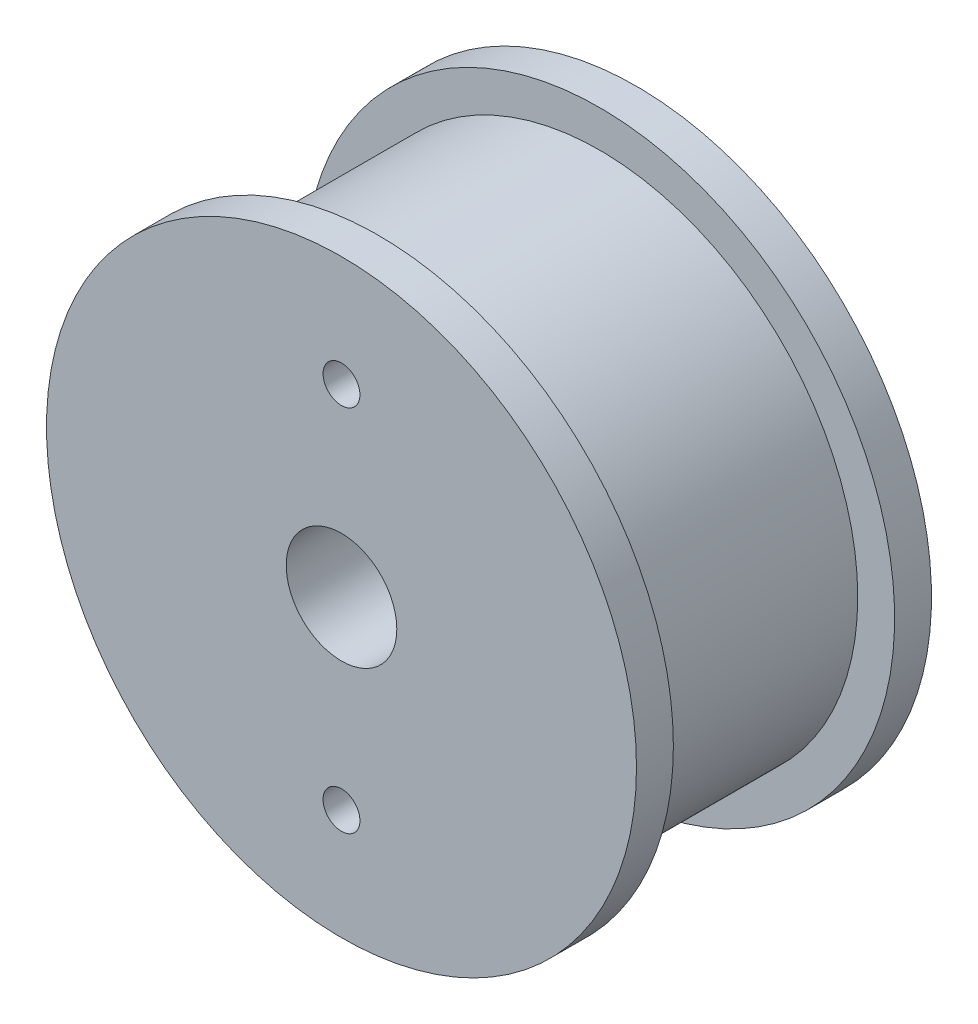
from build123d import *

# Parameters (mm, degrees)
SKETCH1_R           = 35
SKETCH1_R_2         = 12
BOSS_EXTRUDE1_DEPTH = 25
SKETCH2_R           = 35
SKETCH2_R_2         = 12
BOSS_EXTRUDE2_DEPTH = 5
BOSS_EXTRUDE4_START = -10
SKETCH4_R           = 12
SKETCH4_R_2         = 7.5
BOSS_EXTRUDE4_DEPTH = 10
SKETCH5_R           = 40
SKETCH5_R_2         = 7.5
BOSS_EXTRUDE5_DEPTH = 5
BOSS_EXTRUDE6_START = 5
SKETCH6_R           = 40
SKETCH6_R_2         = 12
BOSS_EXTRUDE6_DEPTH = 5
SKETCH7_R           = 2.5
CUT_EXTRUDE1_DEPTH  = 70.282032303


with BuildPart() as part:
    # Sketch1 → Boss-Extrude1 (new body)
    with BuildSketch(Plane.XY):
        Circle(SKETCH1_R)
        Circle(SKETCH1_R_2, mode=Mode.SUBTRACT)
    extrude(amount=BOSS_EXTRUDE1_DEPTH)

    # Sketch2 → Boss-Extrude2 (add)
    with BuildSketch(Plane.XY.offset(25)):
        Circle(SKETCH2_R)
        Circle(SKETCH2_R_2, mode=Mode.SUBTRACT)
    extrude(amount=BOSS_EXTRUDE2_DEPTH)

    # Sketch4 → Boss-Extrude4 (add)
    with BuildSketch(Plane.XY.offset(30).offset(BOSS_EXTRUDE4_START)):
        Circle(SKETCH4_R)
        Circle(SKETCH4_R_2, mode=Mode.SUBTRACT)
    extrude(amount=BOSS_EXTRUDE4_DEPTH)

    # Sketch5 → Boss-Extrude5 (add)
    with BuildSketch(Plane.XY.offset(30)):
        Circle(SKETCH5_R)
        Circle(SKETCH5_R_2, mode=Mode.SUBTRACT)
    extrude(amount=BOSS_EXTRUDE5_DEPTH)

    # Sketch6 → Boss-Extrude6 (add)
    with BuildSketch(Plane(origin=(0, 0, 0), x_dir=(-1, 0, 0), z_dir=(0, 0, -1)).offset(BOSS_EXTRUDE6_START)):
        with Locations(Location((0, 0, 0), (0, 0, 180))):
            Circle(SKETCH6_R)
        Circle(SKETCH6_R_2, mode=Mode.SUBTRACT)
    extrude(amount=-BOSS_EXTRUDE6_DEPTH)

    # Sketch7 → Cut-Extrude1 (cut, through all)
    with BuildSketch(Plane(origin=(0, 0, -5), x_dir=(-1, 0, 0), z_dir=(0, 0, -1))):
        with Locations((0, 25)):
            Circle(SKETCH7_R)
        with Locations((0, -25)):
            Circle(SKETCH7_R)
    extrude(amount=-CUT_EXTRUDE1_DEPTH, mode=Mode.SUBTRACT)


solid = part.part
